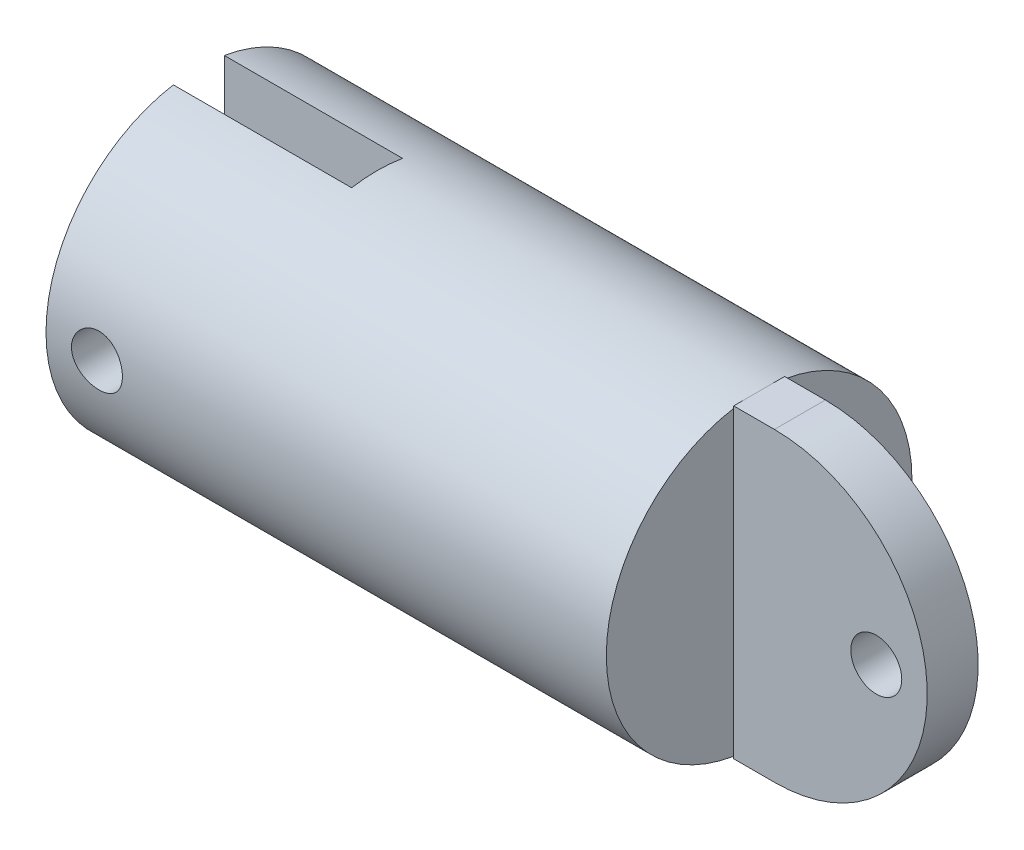
from build123d import *

# Parameters (mm, degrees)
SKETCH2_R               = 15
BOSS_EXTRUDE1_DEPTH     = 55
CUT_EXTRUDE1_DEPTH      = 59.949130613
CUT_EXTRUDE1_DEPTH_BACK = 59.949130613
SKETCH3_W               = 17.5
SKETCH3_H               = 5
CUT_EXTRUDE2_DEPTH      = 59.949130613
CUT_EXTRUDE2_DEPTH_BACK = 59.949130613
SKETCH6_R               = 2.5
SKETCH7_W               = 5
SKETCH7_H               = 30
BOSS_EXTRUDE2_DEPTH     = 4
BOSS_EXTRUDE3_DEPTH     = 5
CUT_EXTRUDE3_DEPTH      = 60.634302356
CUT_EXTRUDE3_DEPTH_BACK = 60.634302356
SKETCH9_R               = 2.5


with BuildPart() as part:
    # Sketch2 → Boss-Extrude1 (new body)
    with BuildSketch(Plane(origin=(0, 0, 0), x_dir=(0, 0, -1), z_dir=(1, 0, 0))):
        Circle(SKETCH2_R)
    extrude(amount=-BOSS_EXTRUDE1_DEPTH)

    # Sketch3 → Cut-Extrude1 (cut, two sides: drawn at the far end of the back side and taken through both)
    with BuildSketch(Plane(origin=(0, 0, 0), x_dir=(1, 0, 0), z_dir=(0, 1, 0)).offset(-CUT_EXTRUDE1_DEPTH_BACK)):
        with Locations((-46.25, 0)):
            Rectangle(SKETCH3_W, SKETCH3_H)
    extrude(amount=CUT_EXTRUDE1_DEPTH + CUT_EXTRUDE1_DEPTH_BACK, mode=Mode.SUBTRACT)

    # Sketch6 → Cut-Extrude2 (cut, two sides: drawn at the far end of the back side and taken through both)
    with BuildSketch(Plane.XY.offset(-CUT_EXTRUDE2_DEPTH_BACK)):
        with Locations((-50, 0)):
            Circle(SKETCH6_R)
    extrude(amount=CUT_EXTRUDE2_DEPTH + CUT_EXTRUDE2_DEPTH_BACK, mode=Mode.SUBTRACT)

    # Sketch7 → Boss-Extrude2 (add)
    with BuildSketch(Plane(origin=(0, 0, 0), x_dir=(0, 0, -1), z_dir=(1, 0, 0))):
        Rectangle(SKETCH7_W, SKETCH7_H)
    extrude(amount=BOSS_EXTRUDE2_DEPTH)

    # Sketch8 → Boss-Extrude3 (add)
    with BuildSketch(Plane.XY.offset(2.5)):
        with BuildLine():
            Line((4, 15), (4, -15))
            ThreePointArc((4, -15), (19, 0), (4, 15))
        make_face()
    extrude(amount=-BOSS_EXTRUDE3_DEPTH)

    # Sketch9 → Cut-Extrude3 (cut, two sides: drawn at the far end of the back side and taken through both)
    with BuildSketch(Plane.XY.offset(2.5).offset(-CUT_EXTRUDE3_DEPTH_BACK)):
        with Locations(Location((14, 0, 0), (0, 0, 270))):
            Circle(SKETCH9_R)
    extrude(amount=CUT_EXTRUDE3_DEPTH + CUT_EXTRUDE3_DEPTH_BACK, mode=Mode.SUBTRACT)


solid = part.part
